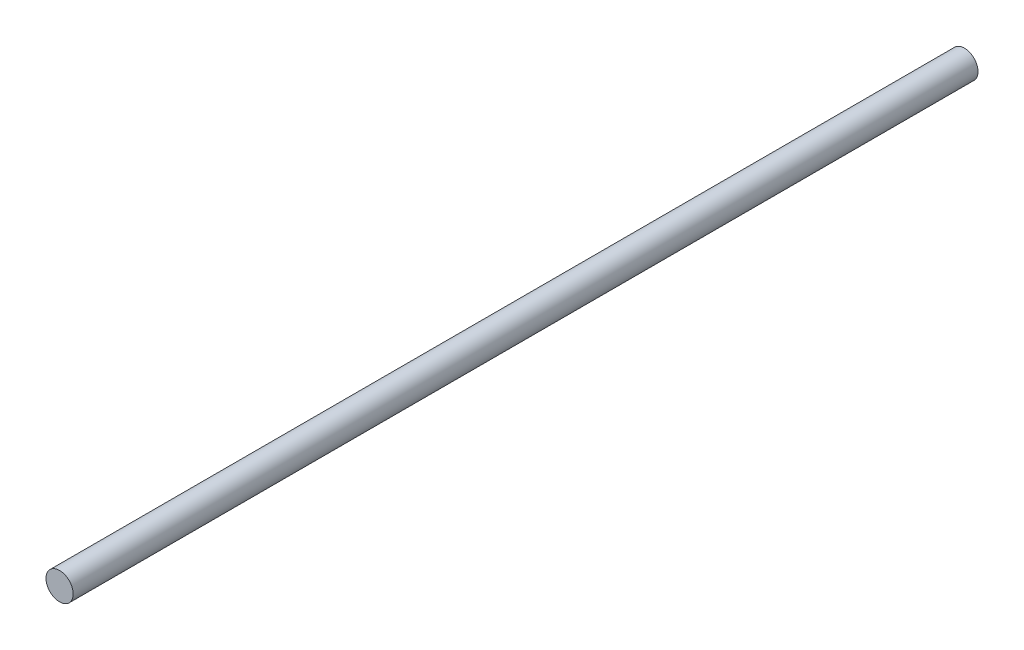
from build123d import *

# Parameters (mm, degrees)
SKETCH1_R           = 6
BOSS_EXTRUDE1_DEPTH = 399
SCALE1_SCALE        = 0.5


with BuildPart() as part:
    # Sketch1 → Boss-Extrude1 (new body)
    with BuildSketch(Plane.XY):
        Circle(SKETCH1_R)
    extrude(amount=BOSS_EXTRUDE1_DEPTH)


with BuildPart() as part_1:
    # Scale1: scaled about (0, 0, 0)
    add(part.part.scale(SCALE1_SCALE))


solid = part_1.part
